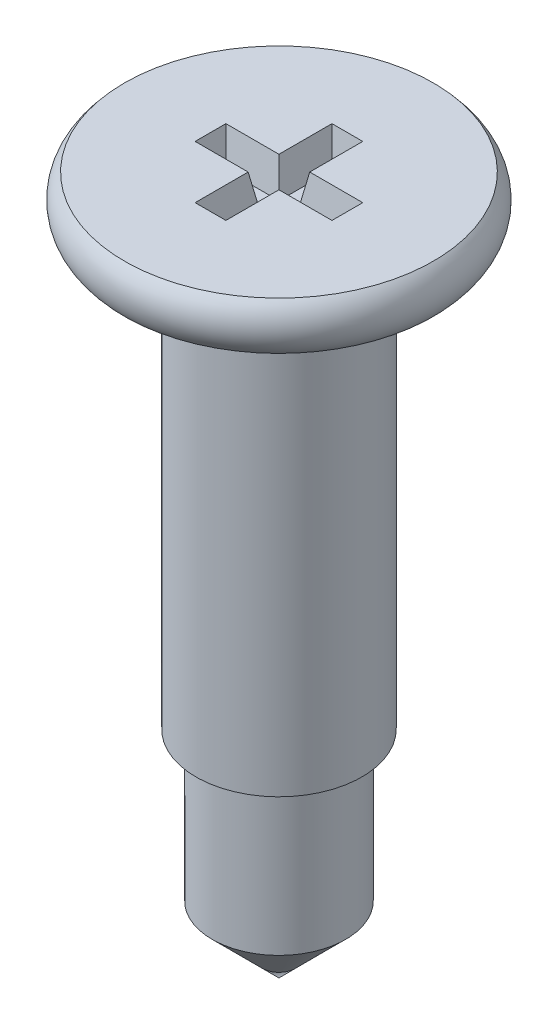
from build123d import *

# Parameters (mm, degrees)
CUT_EXTRUDE1_DEPTH = 1
CUT_EXTRUDE1_DRAFT = -10


with BuildPart() as part:
    # Sketch2 → Revolve1 (revolve)
    with BuildSketch(Plane.XY):
        with BuildLine():
            Line((-2.425, 0), (-2.425, -12.7))
            Line((-2.425, -12.7), (-1.95, -12.7))
            Line((-1.95, -12.7), (-1.95, -17.05))
            Line((-1.95, -17.05), (0, -19))
            Line((0, -19), (0, 0))
            Line((0, 0), (0, 1.4))
            Line((0, 1.4), (-4.514142843, 1.4))
            ThreePointArc((-4.514142843, 1.4), (-4.8, 0.7), (-4.514142843, 0))
            Line((-4.514142843, 0), (-2.425, 0))
        make_face()
    revolve(axis=Axis((0, -19, 0), (0, -1, 0)))


with BuildPart() as cut_extrude1_tool:
    # Sketch3 → Cut-Extrude1 (with draft: the straight prism first)
    with BuildSketch(Plane(origin=(0, 1.4, 0), x_dir=(1, 0, 0), z_dir=(0, 1, 0))):
        Polygon((-0.45, 2), (-0.45, 0.45), (-2, 0.45), (-2, -0.45), (-0.45, -0.45), (-0.45, -2), (0.45, -2), (0.45, -0.45), (2, -0.45), (2, 0.45), (0.45, 0.45), (0.45, 2), align=None)
    extrude(amount=-CUT_EXTRUDE1_DEPTH)
    # Cut-Extrude1: the draft: its side faces are tilted about the plane it starts from
    cut_extrude1_sides = [cut_extrude1_tool.faces().sort_by_distance(p)[0] for p in [
        (-0.45, 0.9, -1.225),
        (-1.225, 0.9, -0.45),
        (-2, 0.9, 0),
        (-1.225, 0.9, 0.45),
        (-0.45, 0.9, 1.225),
        (0, 0.9, 2),
        (0.45, 0.9, 1.225),
        (1.225, 0.9, 0.45),
        (2, 0.9, 0),
        (1.225, 0.9, -0.45),
        (0.45, 0.9, -1.225),
        (0, 0.9, -2),
    ]]
    draft(cut_extrude1_sides, Plane(origin=(0, 1.4, 0), x_dir=(1, 0, 0), z_dir=(0, 1, 0)), CUT_EXTRUDE1_DRAFT)


with BuildPart() as part_1:
    add(part.part)

    # Cut-Extrude1: cut by cut_extrude1_tool
    add(cut_extrude1_tool.part, mode=Mode.SUBTRACT)


solid = part_1.part
